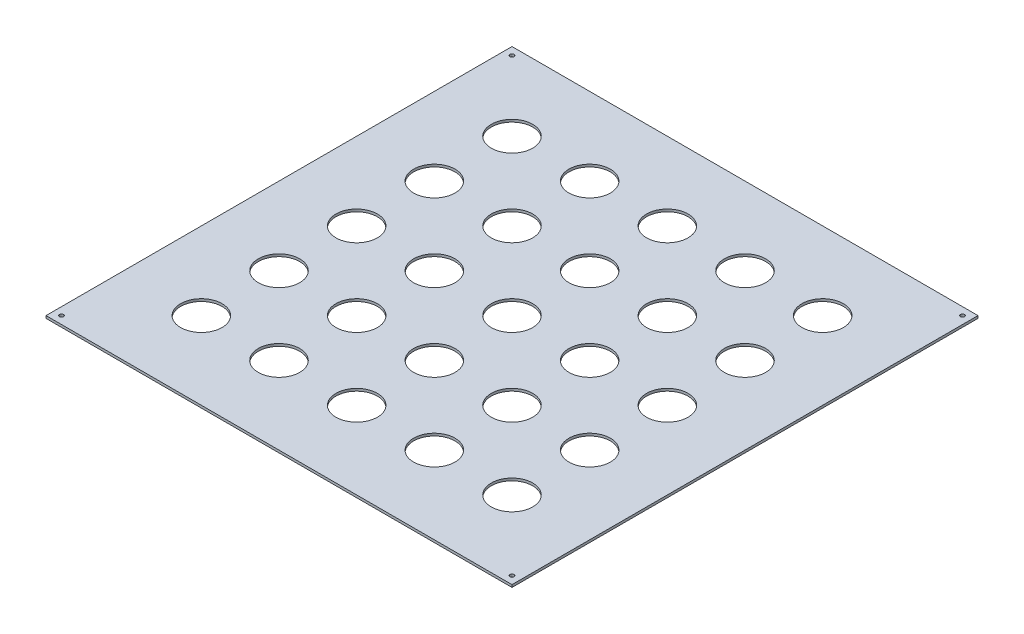
from build123d import *

# Parameters (mm, degrees)
BOSS_EXTRUDE1_DEPTH      = 1.5875
BOSS_EXTRUDE1_DEPTH_BACK = 1.5875
SKETCH1_W                = 600
SKETCH1_H                = 600
SKETCH1_R                = 2.6
SKETCH1_R_2              = 26.67


with BuildPart() as part:
    # Sketch1 → Boss-Extrude1 (new, two sides: drawn at the far end of the back side and taken through both)
    with BuildSketch(Plane(origin=(0, 0, 0), x_dir=(1, 0, 0), z_dir=(0, 1, 0)).offset(-BOSS_EXTRUDE1_DEPTH_BACK)):
        Rectangle(SKETCH1_W, SKETCH1_H)
        with Locations((-290, 290)):
            Circle(SKETCH1_R, mode=Mode.SUBTRACT)
        with Locations((290, 290)):
            Circle(SKETCH1_R, mode=Mode.SUBTRACT)
        with Locations((290, -290)):
            Circle(SKETCH1_R, mode=Mode.SUBTRACT)
        with Locations((-290, -290)):
            Circle(SKETCH1_R, mode=Mode.SUBTRACT)
        Circle(SKETCH1_R_2, mode=Mode.SUBTRACT)
        with Locations((100, 0)):
            Circle(SKETCH1_R_2, mode=Mode.SUBTRACT)
        with Locations((200, 0)):
            Circle(SKETCH1_R_2, mode=Mode.SUBTRACT)
        with Locations((100, 100)):
            Circle(SKETCH1_R_2, mode=Mode.SUBTRACT)
        with Locations((200, 100)):
            Circle(SKETCH1_R_2, mode=Mode.SUBTRACT)
        with Locations((100, 200)):
            Circle(SKETCH1_R_2, mode=Mode.SUBTRACT)
        with Locations((200, 200)):
            Circle(SKETCH1_R_2, mode=Mode.SUBTRACT)
        with Locations((0, 100)):
            Circle(SKETCH1_R_2, mode=Mode.SUBTRACT)
        with Locations((0, 200)):
            Circle(SKETCH1_R_2, mode=Mode.SUBTRACT)
        with Locations((-100, 0)):
            Circle(SKETCH1_R_2, mode=Mode.SUBTRACT)
        with Locations((-200, 0)):
            Circle(SKETCH1_R_2, mode=Mode.SUBTRACT)
        with Locations((-100, -100)):
            Circle(SKETCH1_R_2, mode=Mode.SUBTRACT)
        with Locations((-200, -100)):
            Circle(SKETCH1_R_2, mode=Mode.SUBTRACT)
        with Locations((-100, -200)):
            Circle(SKETCH1_R_2, mode=Mode.SUBTRACT)
        with Locations((-200, -200)):
            Circle(SKETCH1_R_2, mode=Mode.SUBTRACT)
        with Locations((0, -100)):
            Circle(SKETCH1_R_2, mode=Mode.SUBTRACT)
        with Locations((0, -200)):
            Circle(SKETCH1_R_2, mode=Mode.SUBTRACT)
        with Locations((200, -200)):
            Circle(SKETCH1_R_2, mode=Mode.SUBTRACT)
        with Locations((100, -200)):
            Circle(SKETCH1_R_2, mode=Mode.SUBTRACT)
        with Locations((200, -100)):
            Circle(SKETCH1_R_2, mode=Mode.SUBTRACT)
        with Locations((100, -100)):
            Circle(SKETCH1_R_2, mode=Mode.SUBTRACT)
        with Locations((-200, 200)):
            Circle(SKETCH1_R_2, mode=Mode.SUBTRACT)
        with Locations((-100, 200)):
            Circle(SKETCH1_R_2, mode=Mode.SUBTRACT)
        with Locations((-200, 100)):
            Circle(SKETCH1_R_2, mode=Mode.SUBTRACT)
        with Locations((-100, 100)):
            Circle(SKETCH1_R_2, mode=Mode.SUBTRACT)
    extrude(amount=BOSS_EXTRUDE1_DEPTH + BOSS_EXTRUDE1_DEPTH_BACK)


solid = part.part
